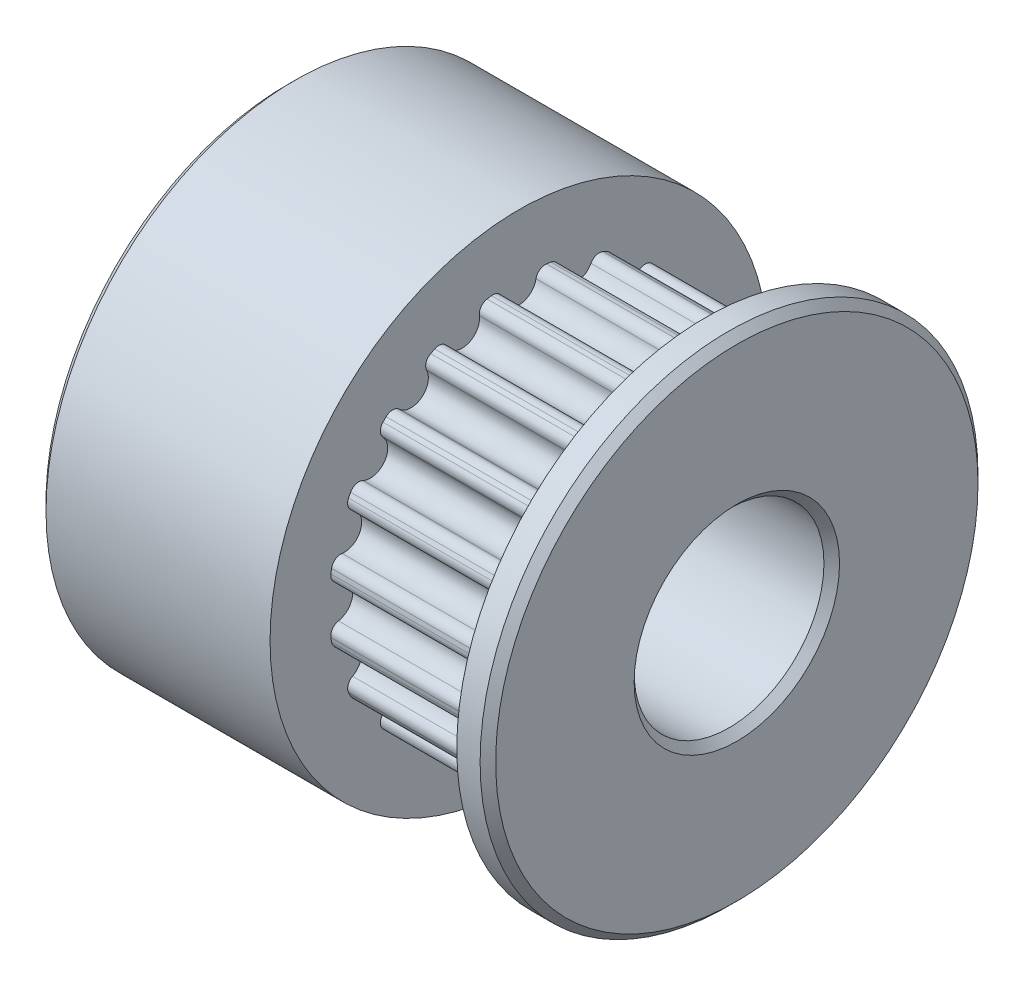
from build123d import *

# Parameters (mm, degrees)
BOSS_EXTRUDE1_DEPTH     = 6
FILLET1_R               = 0.3
SKETCH2_R               = 8
BOSS_EXTRUDE2_DEPTH     = 7.45
BOSS_EXTRUDE3_START     = 1
SKETCH3_R               = 8
BOSS_EXTRUDE3_DEPTH     = 1
CUT_EXTRUDE1_DEPTH      = 14.546309579
CUT_EXTRUDE1_DEPTH_BACK = 14.546309579
SKETCH4_R               = 3.05
CHAMFER1_SIZE           = 0.25
SKETCH5_R               = 1.75
CUT_EXTRUDE2_DEPTH      = 14.546309579
SKETCH6_R               = 1.75
CUT_EXTRUDE3_DEPTH      = 14.546309579


with BuildPart() as part:
    # Sketch1 → Boss-Extrude1 (new body)
    with BuildSketch(Plane(origin=(0, 0, 0), x_dir=(0, 0, -1), z_dir=(1, 0, 0))):
        with BuildLine():
            ThreePointArc((0.5225186, -6.087616472), (0.955814581, -6.034775761), (1.384232226, -5.951134442))
            ThreePointArc((1.384232226, -5.951134442), (1.651861295, -5.083906312), (2.378121664, -5.628200187))
            ThreePointArc((2.378121664, -5.628200187), (2.773881953, -5.444049863), (3.155484757, -5.232113908))
            ThreePointArc((3.155484757, -5.232113908), (3.142026897, -4.324629014), (4.000937611, -4.617856454))
            ThreePointArc((4.000937611, -4.617856454), (4.320422433, -4.320422433), (4.617856454, -4.000937611))
            ThreePointArc((4.617856454, -4.000937611), (4.324629014, -3.142026897), (5.232113908, -3.155484757))
            ThreePointArc((5.232113908, -3.155484757), (5.444049863, -2.773881953), (5.628200187, -2.378121664))
            ThreePointArc((5.628200187, -2.378121664), (5.083906312, -1.651861295), (5.951134442, -1.384232226))
            ThreePointArc((5.951134442, -1.384232226), (6.034775761, -0.955814581), (6.087616472, -0.5225186))
            ThreePointArc((6.087616472, -0.5225186), (5.345535439, 0), (6.087616472, 0.5225186))
            ThreePointArc((6.087616472, 0.5225186), (6.034775761, 0.955814581), (5.951134442, 1.384232226))
            ThreePointArc((5.951134442, 1.384232226), (5.083906312, 1.651861295), (5.628200187, 2.378121664))
            ThreePointArc((5.628200187, 2.378121664), (5.444049863, 2.773881953), (5.232113908, 3.155484757))
            ThreePointArc((5.232113908, 3.155484757), (4.324629014, 3.142026897), (4.617856454, 4.000937611))
            ThreePointArc((4.617856454, 4.000937611), (4.320422433, 4.320422433), (4.000937611, 4.617856454))
            ThreePointArc((4.000937611, 4.617856454), (3.142026897, 4.324629014), (3.155484757, 5.232113908))
            ThreePointArc((3.155484757, 5.232113908), (2.773881953, 5.444049863), (2.378121664, 5.628200187))
            ThreePointArc((2.378121664, 5.628200187), (1.651861295, 5.083906312), (1.384232226, 5.951134442))
            ThreePointArc((1.384232226, 5.951134442), (0.955814581, 6.034775761), (0.5225186, 6.087616472))
            ThreePointArc((0.5225186, 6.087616472), (0, 5.345535439), (-0.5225186, 6.087616472))
            ThreePointArc((-0.5225186, 6.087616472), (-0.955814581, 6.034775761), (-1.384232226, 5.951134442))
            ThreePointArc((-1.384232226, 5.951134442), (-1.651861295, 5.083906312), (-2.378121664, 5.628200187))
            ThreePointArc((-2.378121664, 5.628200187), (-2.773881953, 5.444049863), (-3.155484757, 5.232113908))
            ThreePointArc((-3.155484757, 5.232113908), (-3.142026897, 4.324629014), (-4.000937611, 4.617856454))
            ThreePointArc((-4.000937611, 4.617856454), (-4.320422433, 4.320422433), (-4.617856454, 4.000937611))
            ThreePointArc((-4.617856454, 4.000937611), (-4.324629014, 3.142026897), (-5.232113908, 3.155484757))
            ThreePointArc((-5.232113908, 3.155484757), (-5.444049863, 2.773881953), (-5.628200187, 2.378121664))
            ThreePointArc((-5.628200187, 2.378121664), (-5.083906312, 1.651861295), (-5.951134442, 1.384232226))
            ThreePointArc((-5.951134442, 1.384232226), (-6.034775761, 0.955814581), (-6.087616472, 0.5225186))
            ThreePointArc((-6.087616472, 0.5225186), (-5.345535439, 0), (-6.087616472, -0.5225186))
            ThreePointArc((-6.087616472, -0.5225186), (-6.034775761, -0.955814581), (-5.951134442, -1.384232226))
            ThreePointArc((-5.951134442, -1.384232226), (-5.083906312, -1.651861295), (-5.628200187, -2.378121664))
            ThreePointArc((-5.628200187, -2.378121664), (-5.444049863, -2.773881953), (-5.232113908, -3.155484757))
            ThreePointArc((-5.232113908, -3.155484757), (-4.324629014, -3.142026897), (-4.617856454, -4.000937611))
            ThreePointArc((-4.617856454, -4.000937611), (-4.320422433, -4.320422433), (-4.000937611, -4.617856454))
            ThreePointArc((-4.000937611, -4.617856454), (-3.142026897, -4.324629014), (-3.155484757, -5.232113908))
            ThreePointArc((-3.155484757, -5.232113908), (-2.773881953, -5.444049863), (-2.378121664, -5.628200187))
            ThreePointArc((-2.378121664, -5.628200187), (-1.651861295, -5.083906312), (-1.384232226, -5.951134442))
            ThreePointArc((-1.384232226, -5.951134442), (-0.955814581, -6.034775761), (-0.5225186, -6.087616472))
            ThreePointArc((-0.5225186, -6.087616472), (0, -5.345535439), (0.5225186, -6.087616472))
        make_face()
    extrude(amount=BOSS_EXTRUDE1_DEPTH)

    # Fillet1
    fillet1_edges = [part.edges().sort_by_distance(p)[0] for p in [
        (3, -6.087616472, 0.5225186),
        (3, -5.951134442, 1.384232226),
        (3, -5.628200187, 2.378121664),
        (3, -5.232113908, 3.155484757),
        (3, -4.617856454, 4.000937611),
        (3, -4.000937611, 4.617856454),
        (3, -3.155484757, 5.232113908),
        (3, -2.378121664, 5.628200187),
        (3, -1.384232226, 5.951134442),
        (3, -0.5225186, 6.087616472),
        (3, 0.5225186, 6.087616472),
        (3, 1.384232226, 5.951134442),
        (3, 2.378121664, 5.628200187),
        (3, 3.155484757, 5.232113908),
        (3, 4.000937611, 4.617856454),
        (3, 4.617856454, 4.000937611),
        (3, 5.232113908, 3.155484757),
        (3, 5.628200187, 2.378121664),
        (3, 5.951134442, 1.384232226),
        (3, 6.087616472, 0.5225186),
        (3, 6.087616472, -0.5225186),
        (3, 5.951134442, -1.384232226),
        (3, 5.628200187, -2.378121664),
        (3, 5.232113908, -3.155484757),
        (3, 4.617856454, -4.000937611),
        (3, 4.000937611, -4.617856454),
        (3, 3.155484757, -5.232113908),
        (3, 2.378121664, -5.628200187),
        (3, 1.384232226, -5.951134442),
        (3, 0.5225186, -6.087616472),
        (3, -0.5225186, -6.087616472),
        (3, -1.384232226, -5.951134442),
        (3, -2.378121664, -5.628200187),
        (3, -3.155484757, -5.232113908),
        (3, -4.000937611, -4.617856454),
        (3, -4.617856454, -4.000937611),
        (3, -5.232113908, -3.155484757),
        (3, -5.628200187, -2.378121664),
        (3, -5.951134442, -1.384232226),
        (3, -6.087616472, -0.5225186),
    ]]
    fillet(fillet1_edges, radius=FILLET1_R)

    # Sketch2 → Boss-Extrude2 (add)
    with BuildSketch(Plane(origin=(0, 0, 0), x_dir=(0, 0, -1), z_dir=(1, 0, 0))):
        Circle(SKETCH2_R)
    extrude(amount=-BOSS_EXTRUDE2_DEPTH)

    # Sketch3 → Boss-Extrude3 (add)
    with BuildSketch(Plane(origin=(6, 0, 0), x_dir=(0, 0, -1), z_dir=(1, 0, 0)).offset(BOSS_EXTRUDE3_START)):
        Circle(SKETCH3_R)
    extrude(amount=-BOSS_EXTRUDE3_DEPTH)

    # Sketch4 → Cut-Extrude1 (cut, two sides: drawn at the far end of the back side and taken through both)
    with BuildSketch(Plane(origin=(0, 0, 0), x_dir=(0, 0, -1), z_dir=(1, 0, 0)).offset(-CUT_EXTRUDE1_DEPTH_BACK)):
        Circle(SKETCH4_R)
    extrude(amount=CUT_EXTRUDE1_DEPTH + CUT_EXTRUDE1_DEPTH_BACK, mode=Mode.SUBTRACT)

    # Chamfer1
    chamfer1_edges = [part.edges().sort_by_distance(p)[0] for p in [
        (-7.45, 0, 8),
        (7, 0, 8),
        (-7.45, 0, 3.05),
        (7, 0, 3.05),
    ]]
    chamfer(chamfer1_edges, length=CHAMFER1_SIZE)

    # Sketch5 → Cut-Extrude2 (cut, through all)
    with BuildSketch(Plane.XY):
        with Locations((-3.45, 0)):
            Circle(SKETCH5_R)
    extrude(amount=-CUT_EXTRUDE2_DEPTH, mode=Mode.SUBTRACT)

    # Sketch6 → Cut-Extrude3 (cut, through all)
    with BuildSketch(Plane(origin=(0, 0, 0), x_dir=(1, 0, 0), z_dir=(0, 1, 0))):
        with Locations(Location((-3.45, 0, 0), (0, 0, 270))):
            Circle(SKETCH6_R)
    extrude(amount=-CUT_EXTRUDE3_DEPTH, mode=Mode.SUBTRACT)


solid = part.part
